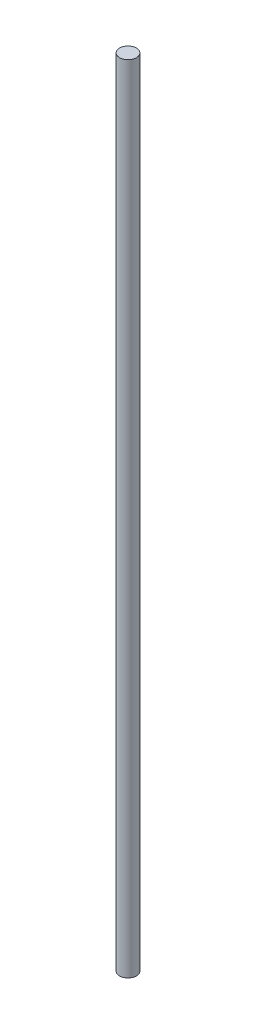
from build123d import *

# Parameters (mm, degrees)
SKETCH1_R           = 4
BOSS_EXTRUDE1_DEPTH = 379.1


with BuildPart() as part:
    # Sketch1 → Boss-Extrude1 (new body)
    with BuildSketch(Plane(origin=(0, 0, 0), x_dir=(1, 0, 0), z_dir=(0, 1, 0))):
        with Locations(Location((0, 0, 0), (0, 0, 270))):
            Circle(SKETCH1_R)
    extrude(amount=BOSS_EXTRUDE1_DEPTH)


solid = part.part
